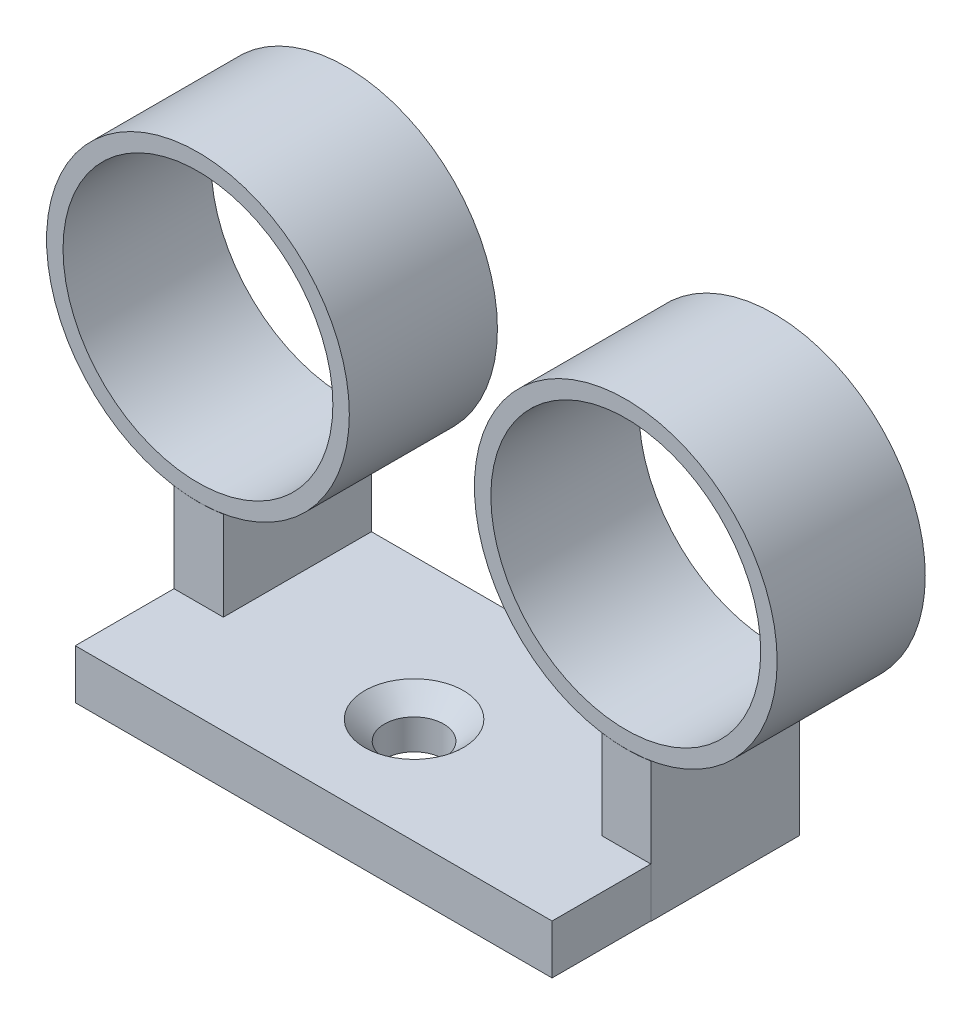
from build123d import *

# Parameters (mm, degrees)
SKETCH1_R             = 9.2
SKETCH1_R_2           = 8.2
BOSS_EXTRUDE1_DEPTH   = 9
BOSS_EXTRUDE1_2_DEPTH = 9
BOSS_EXTRUDE2_DEPTH   = 9
BOSS_EXTRUDE3_DEPTH   = 9
SKETCH4_W             = 28.977386058
SKETCH4_H             = 15
BOSS_EXTRUDE4_DEPTH   = 3


with BuildPart() as part:
    # Sketch1 → Boss-Extrude1 (new body)
    with BuildSketch(Plane.XY):
        with Locations((1.456222439, 17.943073581)):
            Circle(SKETCH1_R)
        with Locations((1.456222439, 17.943073581)):
            Circle(SKETCH1_R_2, mode=Mode.SUBTRACT)
    extrude(amount=BOSS_EXTRUDE1_DEPTH)


with BuildPart() as body_2:
    # Sketch1 → Boss-Extrude1 2 (new body)
    with BuildSketch(Plane.XY):
        with Locations((27.456222439, 17.943073581)):
            Circle(SKETCH1_R)
        with Locations((27.456222439, 17.943073581)):
            Circle(SKETCH1_R_2, mode=Mode.SUBTRACT)
    extrude(amount=BOSS_EXTRUDE1_2_DEPTH)


with BuildPart() as body_3:
    # Sketch2 → Boss-Extrude2 (new body)
    with BuildSketch(Plane.XY):
        with BuildLine():
            Line((0, 0.439053754), (3, 0.439053754))
            Line((3, 0.439053754), (3, 8.859053754))
            ThreePointArc((3, 8.859053754), (1.5, 8.737343973), (0, 8.859053754))
            Line((0, 8.859053754), (0, 0.439053754))
        make_face()
    extrude(amount=BOSS_EXTRUDE2_DEPTH)



with BuildPart() as body_4:
    # Sketch3 → Boss-Extrude3 (new body)
    with BuildSketch(Plane.XY):
        with BuildLine():
            Line((26, 0.439053754), (29, 0.439053754))
            Line((29, 0.439053754), (29, 8.859053754))
            ThreePointArc((29, 8.859053754), (27.5, 8.737343973), (26, 8.859053754))
            Line((26, 8.859053754), (26, 0.439053754))
        make_face()
    extrude(amount=BOSS_EXTRUDE3_DEPTH)


with BuildPart() as body_3_1:
    add(body_3.part)

    add(body_4.part)  # Boss-Extrude4 merges body 4
    # Sketch4 → Boss-Extrude4 (add)
    with BuildSketch(Plane(origin=(0, 0.439053754, 0), x_dir=(-1, 0, 0), z_dir=(0, -1, 0))):
        with Locations((-14.488693029, -7.5)):
            Rectangle(SKETCH4_W, SKETCH4_H)
    extrude(amount=-BOSS_EXTRUDE4_DEPTH)

    # Sketch5 → Avellanado para tornillo con cabeza avellanada en cruz de M31 (revolve, cut)
    with BuildSketch(Plane(origin=(14.156348597, 3.439053754, 8.566218105), x_dir=(0, 0, 1), z_dir=(1, 0, 0))):
        Polygon((0, 0), (0, 11.081549114), (1.8, 10), (1.8, 1.15882653), (3, 0), align=None)
    revolve(axis=Axis((14.156348597, 9.789053754, 8.566218105), (0, -1, 0)), mode=Mode.SUBTRACT)


solid = Compound([part.part, body_2.part, body_3_1.part])
